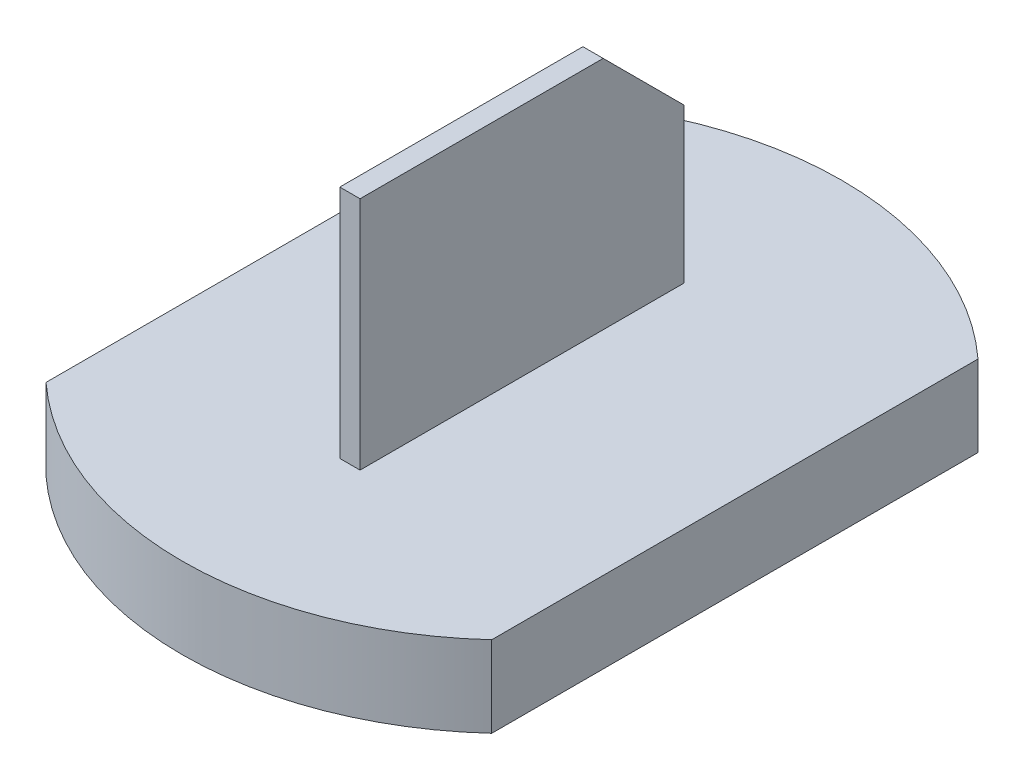
from build123d import *

# Parameters (mm, degrees)
SKETCH1_W                = 69.85
SKETCH1_H                = 76.2
SKETCH1_W_2              = 3.175
SKETCH1_H_2              = 50.8
BOSS_EXTRUDE1_DEPTH      = 6.35
BOSS_EXTRUDE2_DEPTH      = 43.18
BOSS_EXTRUDE2_DEPTH_BACK = 6.35
SKETCH1_3_W              = 3.175
SKETCH1_3_H              = 50.8
CHAMFER1_SIZE            = 12.7


with BuildPart() as part:
    # Sketch1 → Boss-Extrude1 (new, symmetric)
    # profile 1 of 3: a face of its own
    with BuildSketch(Plane(origin=(0, 0, 0), x_dir=(1, 0, 0), z_dir=(0, 1, 0))):
        Rectangle(SKETCH1_W, SKETCH1_H)
        Rectangle(SKETCH1_W_2, SKETCH1_H_2, mode=Mode.SUBTRACT)
    # profile 2 of 3: a face of its own
    with BuildSketch(Plane(origin=(0, 0, 0), x_dir=(1, 0, 0), z_dir=(0, 1, 0))):
        with BuildLine():
            Line((-34.925, 38.1), (34.925, 38.1))
            ThreePointArc((34.925, 38.1), (0, 51.685255393), (-34.925, 38.1))
        make_face()
    # profile 3 of 3: a face of its own
    with BuildSketch(Plane(origin=(0, 0, 0), x_dir=(1, 0, 0), z_dir=(0, 1, 0))):
        with BuildLine():
            ThreePointArc((-34.925, -38.1), (0, -51.685255393), (34.925, -38.1))
            Line((34.925, -38.1), (-34.925, -38.1))
        make_face()
    extrude(amount=BOSS_EXTRUDE1_DEPTH, both=True)

    # Sketch1<3> → Boss-Extrude2 (add, two sides: drawn at the far end of the back side and taken through both)
    with BuildSketch(Plane(origin=(0, 0, 0), x_dir=(1, 0, 0), z_dir=(0, 1, 0)).offset(-BOSS_EXTRUDE2_DEPTH_BACK)):
        Rectangle(SKETCH1_3_W, SKETCH1_3_H)
    extrude(amount=BOSS_EXTRUDE2_DEPTH + BOSS_EXTRUDE2_DEPTH_BACK)

    # Chamfer1
    chamfer1_edges = [part.edges().sort_by_distance(p)[0] for p in [
        (0, 43.18, -25.4),
    ]]
    chamfer(chamfer1_edges, length=CHAMFER1_SIZE)


solid = part.part
